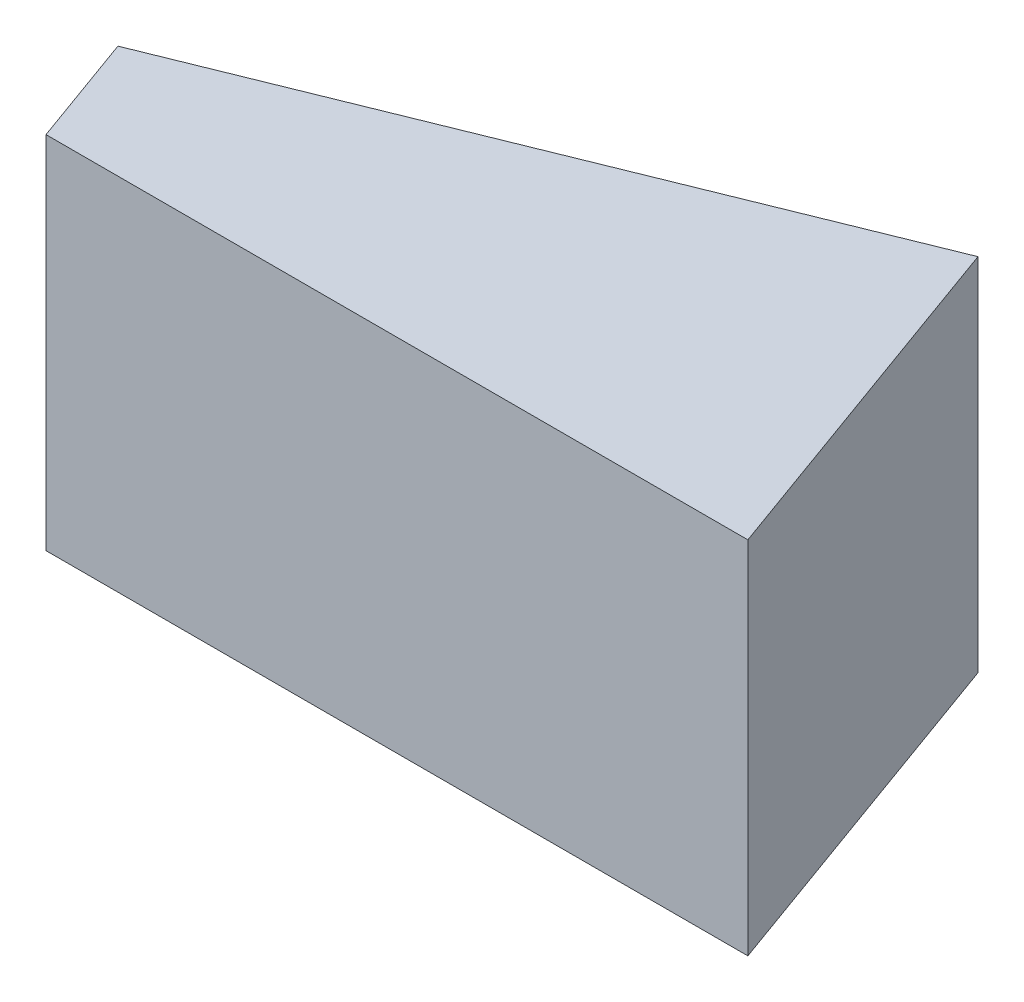
from build123d import *

# Parameters (mm, degrees)
BOSS_EXTRUDE1_DEPTH = 38.1


with BuildPart() as part:
    # Sketch1 → Boss-Extrude1 (new body)
    with BuildSketch(Plane(origin=(0, 0, 0), x_dir=(1, 0, 0), z_dir=(0, 1, 0))):
        Polygon((29.433037746, 11.90625), (33.734375, 0), (94.185720786, 0), (94.185720786, 38.1), align=None)
        Polygon((94.185720786, 38.1), (94.185720786, 0), (107.95, 0), align=None)
    extrude(amount=BOSS_EXTRUDE1_DEPTH)


solid = part.part
